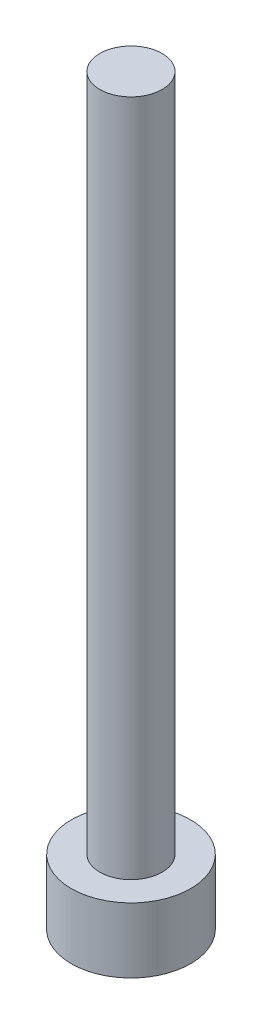
from build123d import *

# Parameters (mm, degrees)
SKETCH_1_R          = 2.2
EXTRUDE_1_DEPTH     = 2.4
EXTRUDE_START       = 2.4
SKETCH_1_4_R        = 1.15
EXTRUDE_2_DEPTH     = 25
CUT_EXTRUDE_1_DEPTH = 1.5


with BuildPart() as part:
    # 草图1 → 凸台-拉伸1 (new body)
    with BuildSketch(Plane(origin=(0, 0, 0), x_dir=(1, 0, 0), z_dir=(0, 1, 0))):
        with Locations(Location((0, 0, 0), (0, 0, 270))):
            Circle(SKETCH_1_R)
    extrude(amount=EXTRUDE_1_DEPTH)

    # 草图1<4> → 凸台-拉伸2 (add)
    with BuildSketch(Plane(origin=(0, 0, 0), x_dir=(1, 0, 0), z_dir=(0, 1, 0)).offset(EXTRUDE_START)):
        with Locations(Location((0, 0, 0), (0, 0, 270))):
            Circle(SKETCH_1_4_R)
    extrude(amount=EXTRUDE_2_DEPTH)

    # 草图1<3> → 切除-拉伸1 (cut)
    with BuildSketch(Plane(origin=(0, 0, 0), x_dir=(1, 0, 0), z_dir=(0, 1, 0))):
        with BuildLine():
            ThreePointArc((1.15, 0), (1.149992705, 0.004096081), (1.149970821, 0.008192111))
            Line((1.149970821, 0.008192111), (0.582079986, 0.991807889))
            ThreePointArc((0.582079986, 0.991807889), (0.575, 0.995929214), (0.567890835, 1))
            Line((0.567890835, 1), (-0.567890835, 1))
            ThreePointArc((-0.567890835, 1), (-0.575, 0.995929214), (-0.582079986, 0.991807889))
            Line((-0.582079986, 0.991807889), (-1.149970821, 0.008192111))
            ThreePointArc((-1.149970821, 0.008192111), (-1.15, 0), (-1.149970821, -0.008192111))
            Line((-1.149970821, -0.008192111), (-0.582079986, -0.991807889))
            ThreePointArc((-0.582079986, -0.991807889), (-0.575, -0.995929214), (-0.567890835, -1))
            Line((-0.567890835, -1), (0.567890835, -1))
            ThreePointArc((0.567890835, -1), (0.575, -0.995929214), (0.582079986, -0.991807889))
            Line((0.582079986, -0.991807889), (1.149970821, -0.008192111))
            ThreePointArc((1.149970821, -0.008192111), (1.149992705, -0.004096081), (1.15, 0))
        make_face()
    extrude(amount=CUT_EXTRUDE_1_DEPTH, mode=Mode.SUBTRACT)


solid = part.part
